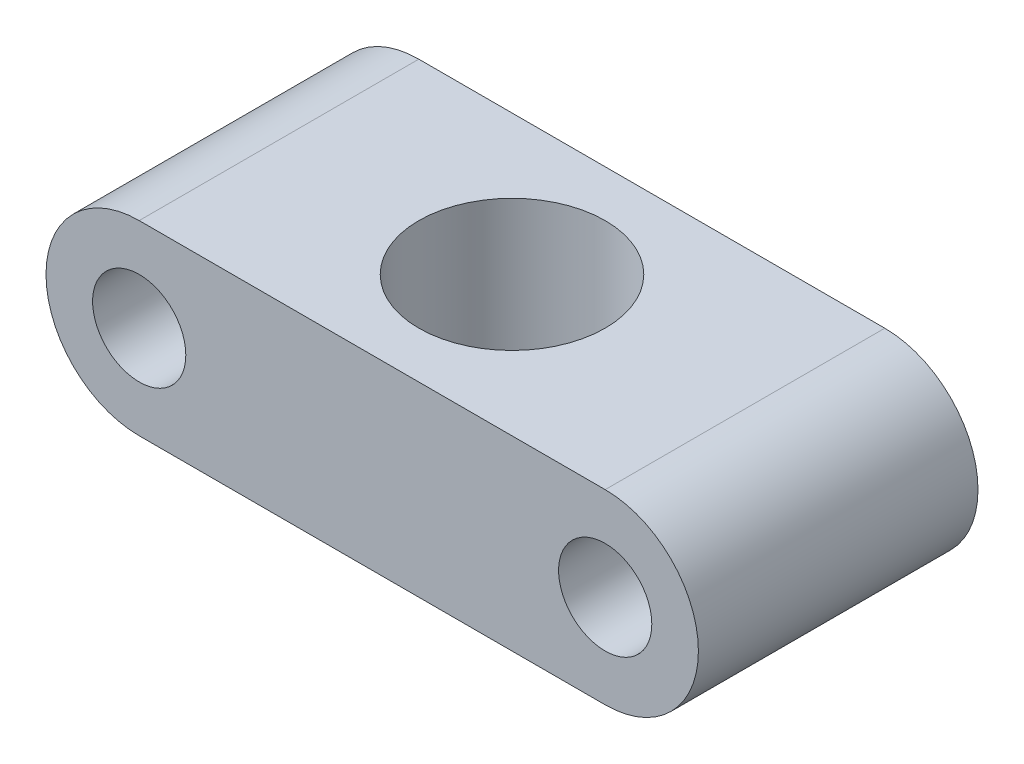
from build123d import *

# Parameters (mm, degrees)
IZIM2_R                     = 5
Y_KSEKLIK_EKSTR_ZYON2_DEPTH = 30
IZIM3_R                     = 10
KES_EKSTR_ZYON1_DEPTH       = 20


with BuildPart() as part:
    # Çizim2 → Yükseklik-Ekstrüzyon2 (new body)
    with BuildSketch(Plane.XY):
        with BuildLine():
            Line((-45.944380081, 21.690872668), (4.055619919, 21.690872668))
            ThreePointArc((4.055619919, 21.690872668), (14.055619919, 11.690872668), (4.055619919, 1.690872668))
            Line((4.055619919, 1.690872668), (-45.944380081, 1.690872668))
            ThreePointArc((-45.944380081, 1.690872668), (-55.944380081, 11.690872668), (-45.944380081, 21.690872668))
        make_face()
        with Locations((-45.944380081, 11.690872668)):
            Circle(IZIM2_R, mode=Mode.SUBTRACT)
        with Locations((4.055619919, 11.690872668)):
            Circle(IZIM2_R, mode=Mode.SUBTRACT)
    extrude(amount=Y_KSEKLIK_EKSTR_ZYON2_DEPTH)

    # Çizim3 → Kes-Ekstrüzyon1 (cut)
    with BuildSketch(Plane(origin=(0, 21.690872668, 0), x_dir=(1, 0, 0), z_dir=(0, 1, 0))):
        with Locations(Location((-20.944380081, -15, 0), (0, 0, 270))):
            Circle(IZIM3_R)
    extrude(amount=-KES_EKSTR_ZYON1_DEPTH, mode=Mode.SUBTRACT)


solid = part.part
